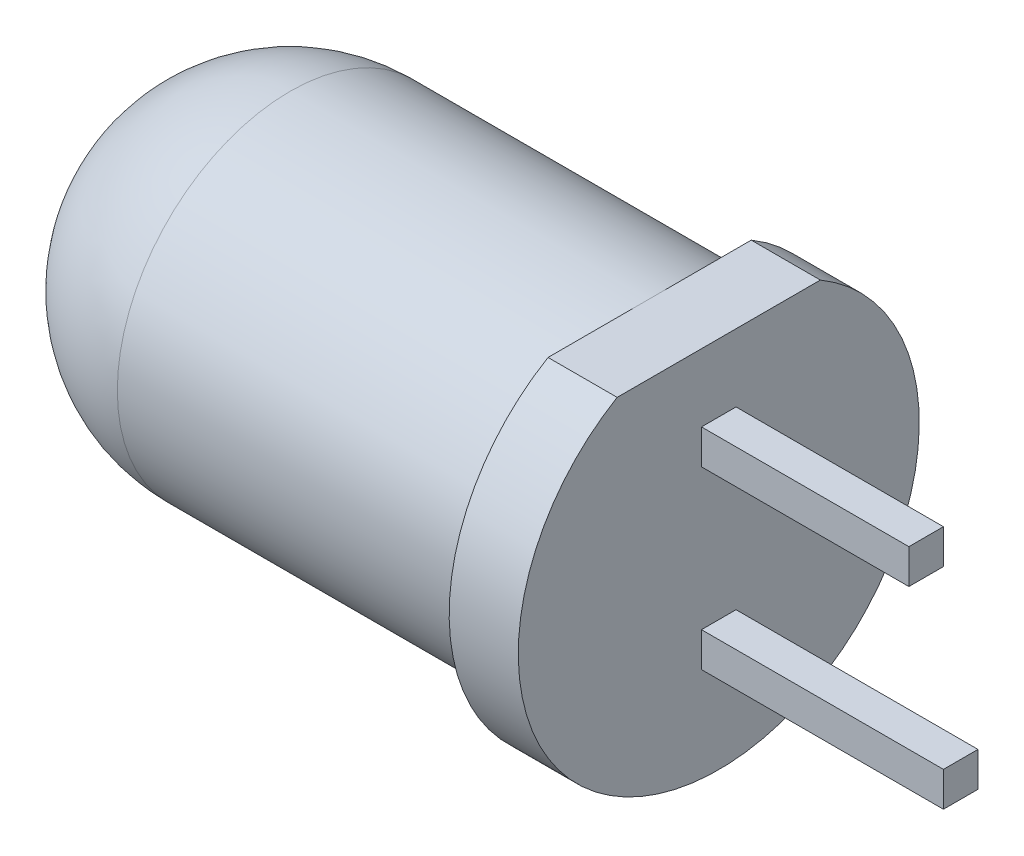
from build123d import *

# Parameters (mm, degrees)
CUT_EXTRUDE_1_REACH = 11.618
SKETCH_2_W          = 0.5
SKETCH_2_H          = 0.5
EXTRUDE_1_DEPTH     = 3.5
SKETCH_2_3_W        = 0.5
SKETCH_2_3_H        = 0.5
EXTRUDE_2_DEPTH     = 3


with BuildPart() as part:
    # 草图1 → 旋转1 (revolve)
    with BuildSketch(Plane.XY):
        with BuildLine():
            Line((0, 2.5), (5.2, 2.5))
            Line((5.2, 2.5), (5.2, 2.9))
            Line((5.2, 2.9), (6.2, 2.9))
            Line((6.2, 2.9), (6.2, 2.5))
            Line((6.2, 2.5), (6.2, 0))
            Line((6.2, 0), (-2.5, 0))
            ThreePointArc((-2.5, 0), (-1.767766953, 1.767766953), (0, 2.5))
        make_face()
    revolve(axis=Axis((-3.104685715, 0, 0), (1, 0, 0)))

    # 草图4 → 切除-拉伸1 (cut, up to next)
    with BuildSketch(Plane(origin=(6.2, 0, 0), x_dir=(0, 0, -1), z_dir=(1, 0, 0)), mode=Mode.PRIVATE) as cut_extrude_1_sk1:
        with BuildLine():
            Line((-1.469693846, 2.5), (1.469693846, 2.5))
            ThreePointArc((1.469693846, 2.5), (0, 2.9), (-1.469693846, 2.5))
        make_face()
    cut_extrude_1_tool1 = extrude(cut_extrude_1_sk1.sketch, amount=-CUT_EXTRUDE_1_REACH, mode=Mode.PRIVATE) & part.part
    add(cut_extrude_1_tool1.solids().sort_by_distance((6.2, 2.660985, 0))[0], mode=Mode.SUBTRACT)

    # 草图2 → 凸台-拉伸1 (add)
    with BuildSketch(Plane(origin=(6.2, 0, 0), x_dir=(0, 0, -1), z_dir=(1, 0, 0))):
        with Locations((0, -1.27)):
            Rectangle(SKETCH_2_W, SKETCH_2_H)
    extrude(amount=EXTRUDE_1_DEPTH)

    # 草图2<3> → 凸台-拉伸2 (add)
    with BuildSketch(Plane(origin=(6.2, 0, 0), x_dir=(0, 0, -1), z_dir=(1, 0, 0))):
        with Locations((0, 1.27)):
            Rectangle(SKETCH_2_3_W, SKETCH_2_3_H)
    extrude(amount=EXTRUDE_2_DEPTH)


solid = part.part
